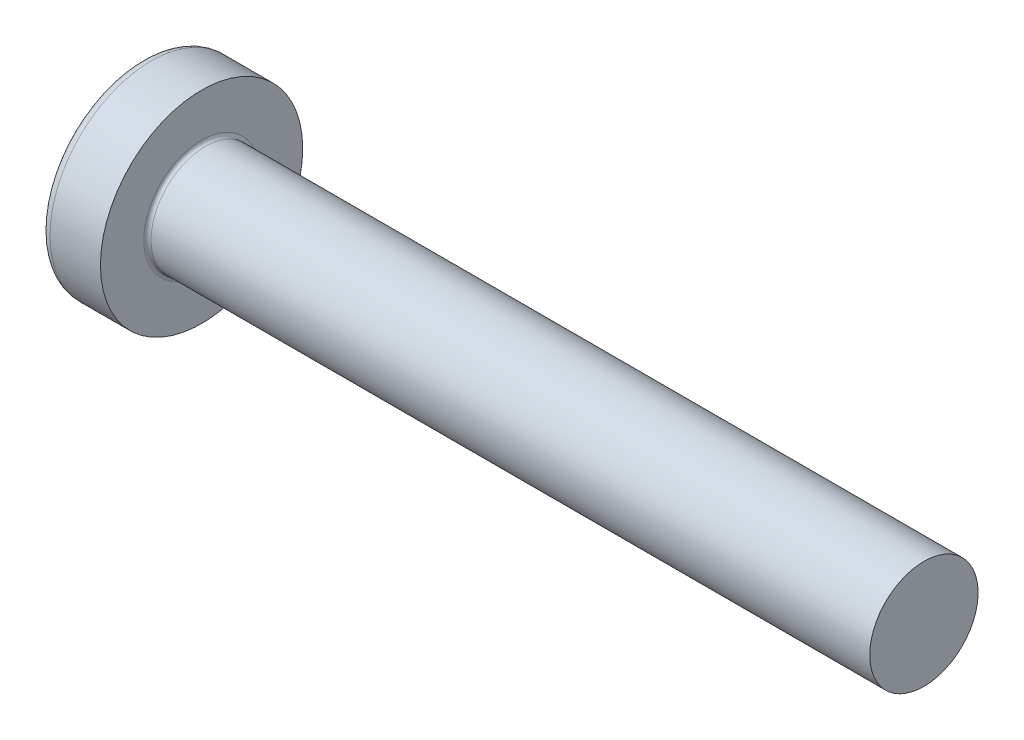
from build123d import *

# Parameters (mm, degrees)
FILLET1_R    = 0.1
RECPAT_COUNT = 2
RECPAT_ANGLE = 90


with BuildPart() as part:
    # BodySke → Base-Revolve (revolve)
    with BuildSketch(Plane.XY, mode=Mode.PRIVATE) as base_revolve_sk:
        with BuildLine():
            Line((2.4, 1.5), (2.4, 2.8))
            Line((2.4, 2.8), (1.003501533, 2.8))
            ThreePointArc((1.003501533, 2.8), (0.873295971, 2.76653015), (0.775371599, 2.674418605))
            ThreePointArc((0.775371599, 2.674418605), (0.197753546, 1.392274756), (0, 0))
            Line((0, 0), (22.4, 0))
            Line((22.4, 0), (22.4, 1.5))
            Line((22.4, 1.5), (2.4, 1.5))
        make_face()
    revolve(base_revolve_sk.sketch.rotate(Axis((1.003501533, 0, 0), (1, 0, 0)), 90), axis=Axis((1.003501533, 0, 0), (1, 0, 0)))

    # Fillet1
    fillet1_edges = [part.edges().sort_by_distance(p)[0] for p in [
        (2.4, 0, -1.5),
    ]]
    fillet(fillet1_edges, radius=FILLET1_R)

    # Sketch3 → Recess section 0
    with BuildSketch(Plane(origin=(0, 0, 0), x_dir=(0, 0, -1), z_dir=(1, 0, 0))):
        with BuildLine():
            Line((0.37, -1.4), (-0.37, -1.4))
            Line((-0.37, -1.4), (-0.37, 1.4))
            Line((-0.37, 1.4), (0.37, 1.4))
            Line((0.37, 1.4), (0.37, -1.4))
        make_face()
    # Sketch4 → Recess section 1
    with BuildSketch(Plane(origin=(1.75, 0, 0), x_dir=(0, 0, -1), z_dir=(1, 0, 0))):
        with BuildLine():
            Line((0.37, -0.527482332), (-0.37, -0.527482332))
            Line((-0.37, -0.527482332), (-0.37, 0.527482332))
            Line((-0.37, 0.527482332), (0.37, 0.527482332))
            Line((0.37, 0.527482332), (0.37, -0.527482332))
        make_face()
    recess = loft(mode=Mode.SUBTRACT)

    # RecPat: Recess ×2 about axis
    recpat_axis = Axis((0, 0, 0), (1, 0, 0))
    for i in range(1, RECPAT_COUNT):
        add(recess.rotate(recpat_axis, i * RECPAT_ANGLE / (RECPAT_COUNT - 1)), mode=Mode.SUBTRACT)

    # RecCorSke → RecessCore (revolve, cut)
    with BuildSketch(Plane.XY, mode=Mode.PRIVATE) as recesscore_sk:
        Polygon((0, 0), (0, 0.678371921), (1.75, 0.556), (1.930655351, 0), align=None)
    revolve(recesscore_sk.sketch.rotate(Axis((-3.175, 0, 0), (1, 0, 0)), 344.185974362), axis=Axis((-3.175, 0, 0), (1, 0, 0)), mode=Mode.SUBTRACT)


solid = part.part
